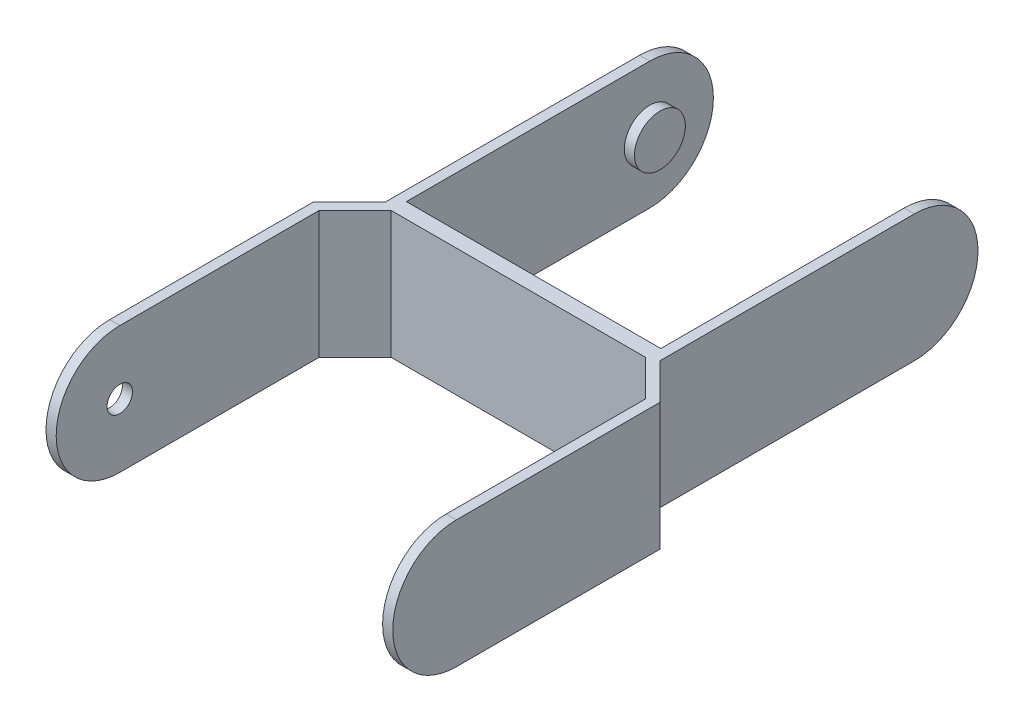
from build123d import *

# Parameters (mm, degrees)
BOSS_EXTRU_1_DEPTH      = 25
BOSS_EXTRU_2_DEPTH      = 2
BOSS_EXTRU_3_DEPTH      = 2
BOSS_EXTRU_4_START      = -2
BOSS_EXTRU_4_DEPTH      = 2
BOSS_EXTRU_5_START      = -2
BOSS_EXTRU_5_DEPTH      = 2
ESQUISSE6_R             = 2.5
ENL_V_MAT_EXTRU_1_DEPTH = 10
ESQUISSE7_R             = 5
BOSS_EXTRU_6_DEPTH      = 2
ESQUISSE9_R             = 5
BOSS_EXTRU_8_DEPTH      = 2
ESQUISSE10_R            = 2.5
BOSS_EXTRU_9_DEPTH      = 2


with BuildPart() as part:
    # Esquisse1 → Boss.-Extru.1 (new body)
    with BuildSketch(Plane(origin=(0, 0, 0), x_dir=(1, 0, 0), z_dir=(0, 1, 0))):
        Polygon((-34.071067812, -59.102794325), (-34.071067812, -19.102794325), (-27, -12.031726513), (-27, 37.968273487), (-25, 37.968273487), (-25, -9.860153638), (25, -9.860153638), (25, 37.968273487), (27, 37.968273487), (27, -12.031726513), (34.071067812, -19.102794325), (34.071067812, -59.102794325), (32.071067812, -59.102794325), (32.071067812, -19.93122145), (25, -12.860153638), (-25, -12.860153638), (-32.071067812, -19.93122145), (-32.071067812, -59.102794325), align=None)
    extrude(amount=BOSS_EXTRU_1_DEPTH)

    # Esquisse2 → Boss.-Extru.2 (add)
    with BuildSketch(Plane(origin=(34.071067812, 0, 0), x_dir=(0, 0, -1), z_dir=(1, 0, 0))):
        with BuildLine():
            Line((-59.102794325, 0), (-19.102794325, 0))
            Line((-19.102794325, 0), (-19.102794325, 25))
            Line((-19.102794325, 25), (-59.102794325, 25))
            ThreePointArc((-59.102794325, 25), (-71.602794325, 12.5), (-59.102794325, 0))
        make_face()
    extrude(amount=-BOSS_EXTRU_2_DEPTH)

    # Esquisse3 → Boss.-Extru.3 (add)
    with BuildSketch(Plane(origin=(27, 0, 0), x_dir=(0, 0, -1), z_dir=(1, 0, 0))):
        with BuildLine():
            Line((37.968273487, 25), (37.968273487, 0))
            ThreePointArc((37.968273487, 0), (50.468273487, 12.5), (37.968273487, 25))
        make_face()
    extrude(amount=-BOSS_EXTRU_3_DEPTH)

    # Esquisse4 → Boss.-Extru.4 (add)
    with BuildSketch(Plane.ZY.offset(34.071067812).offset(BOSS_EXTRU_4_START)):
        with BuildLine():
            Line((59.102794325, 25), (59.102794325, 0))
            ThreePointArc((59.102794325, 0), (71.602794325, 12.5), (59.102794325, 25))
        make_face()
    extrude(amount=BOSS_EXTRU_4_DEPTH)

    # Esquisse5 → Boss.-Extru.5 (add)
    with BuildSketch(Plane.ZY.offset(27).offset(BOSS_EXTRU_5_START)):
        with BuildLine():
            Line((-37.968273487, 0), (-37.968273487, 25))
            ThreePointArc((-37.968273487, 25), (-50.468273487, 12.5), (-37.968273487, 0))
        make_face()
    extrude(amount=BOSS_EXTRU_5_DEPTH)

    # Esquisse6 → Enlèv. mat.-Extru.1 (cut)
    with BuildSketch(Plane.ZY.offset(34.071067812)):
        with Locations((59.102794325, 12.5)):
            Circle(ESQUISSE6_R)
    extrude(amount=-ENL_V_MAT_EXTRU_1_DEPTH, mode=Mode.SUBTRACT)

    # Esquisse7 → Boss.-Extru.6 (add)
    with BuildSketch(Plane(origin=(-25, 0, 0), x_dir=(0, 0, -1), z_dir=(1, 0, 0))):
        with Locations((37.968273487, 12.5)):
            Circle(ESQUISSE7_R)
    extrude(amount=BOSS_EXTRU_6_DEPTH)

    # Esquisse9 → Boss.-Extru.8 (add)
    with BuildSketch(Plane.ZY.offset(-25)):
        with Locations(Location((-39.433505518, 13.150947635, 0), (0, 0, 180))):
            Circle(ESQUISSE9_R)
    extrude(amount=BOSS_EXTRU_8_DEPTH)

    # Esquisse10 → Boss.-Extru.9 (add)
    with BuildSketch(Plane.ZY.offset(-23)):
        with Locations((-39.433505518, 13.150947635)):
            Circle(ESQUISSE10_R)
    extrude(amount=BOSS_EXTRU_9_DEPTH)


solid = part.part
